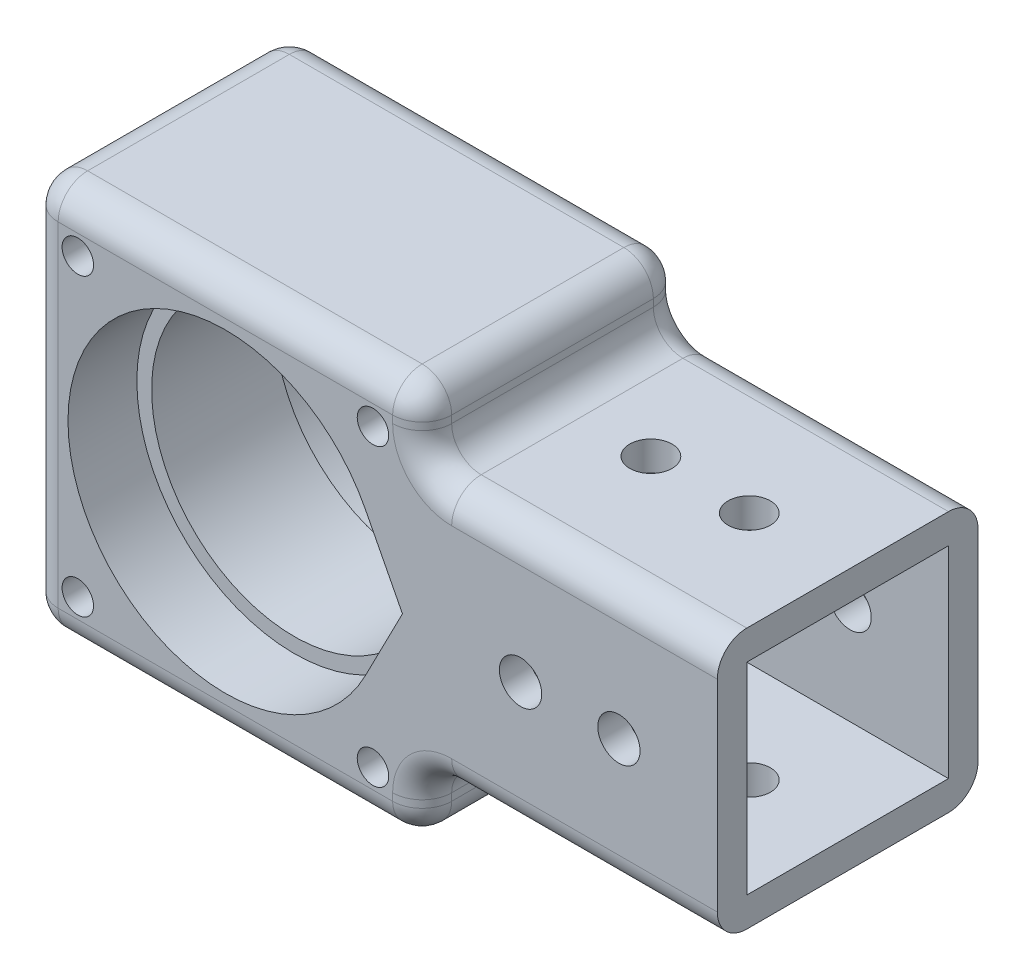
from build123d import *

# Parameters (mm, degrees)
SKETCH_1_W           = 17.5
SKETCH_1_H           = 17.5
EXTRUDE_1_DEPTH      = 30
SKETCH_2_W           = 20.5
SKETCH_2_H           = 20.5
SKETCH_2_W_2         = 17.5
SKETCH_2_H_2         = 17.5
EXTRUDE_2_DEPTH      = 2
SKETCH_3_W           = 26.5
SKETCH_3_H           = 26.5
SKETCH_3_W_2         = 20.5
SKETCH_3_H_2         = 20.5
EXTRUDE_3_DEPTH      = 30
SKETCH_4_R           = 2.15
CUT_EXTRUDE_6_DEPTH  = 43.164113888
SKETCH_6_W           = 10
SKETCH_6_H           = 26.5
SKETCH_6_H_2         = 6.75
EXTRUDE_5_DEPTH      = 40
SKETCH_14_R          = 1.6
CUT_EXTRUDE_9_DEPTH  = 52.983170353
SKETCH_5_R           = 2.15
CUT_EXTRUDE_10_DEPTH = 52.983170353
SKETCH_15_W          = 17.5
SKETCH_15_H          = 17.5
CUT_EXTRUDE_12_DEPTH = 28
CUT_EXTRUDE_13_DEPTH = 28
CUT_EXTRUDE_14_DEPTH = 59.099591221
SKETCH_18_R          = 16
CUT_EXTRUDE_15_DEPTH = 10
CUT_EXTRUDE_16_DEPTH = 10
SKETCH_20_W          = 40.335449496
SKETCH_20_H          = 40
CUT_EXTRUDE_17_DEPTH = 3
EXTRUDE_START        = -40
SKETCH_21_R          = 1.5
EXTRUDE_6_DEPTH      = 40
SKETCH_22_R          = 16
CUT_EXTRUDE_18_DEPTH = 40
SKETCH_24_W          = 40
SKETCH_24_H          = 40
SKETCH_24_R          = 1.6
SKETCH_24_R_2        = 14.5
EXTRUDE_7_DEPTH      = 12.5
SKETCH_25_R          = 1.6
EXTRUDE_8_DEPTH      = 7
FILLET_1_R           = 3
FILLET_2_R           = 3
FILLET_3_R           = 3
FILLET_4_R           = 3
FILLET_5_R           = 3
FILLET_6_R           = 3
FILLET_7_R           = 3
FILLET_8_R           = 3


with BuildPart() as part:
    # 草图1 → 凸台-拉伸1 (new body)
    with BuildSketch(Plane(origin=(0, 0, 0), x_dir=(0, 0, -1), z_dir=(1, 0, 0))):
        Rectangle(SKETCH_1_W, SKETCH_1_H)
    extrude(amount=EXTRUDE_1_DEPTH)

    # 草图2 → 凸台-拉伸2 (add)
    with BuildSketch(Plane.ZY):
        Rectangle(SKETCH_2_W, SKETCH_2_H)
        Rectangle(SKETCH_2_W_2, SKETCH_2_H_2, mode=Mode.SUBTRACT)
    extrude(amount=-EXTRUDE_2_DEPTH)

    # 草图3 → 凸台-拉伸3 (add)
    with BuildSketch(Plane.ZY):
        Rectangle(SKETCH_3_W, SKETCH_3_H)
        Rectangle(SKETCH_3_W_2, SKETCH_3_H_2, mode=Mode.SUBTRACT)
    extrude(amount=-EXTRUDE_3_DEPTH)

    # 草图4 → 切除-拉伸6 (cut, through all)
    with BuildSketch(Plane(origin=(0, 13.25, 0), x_dir=(1, 0, 0), z_dir=(0, 1, 0))):
        with Locations(Location((10, 0, 0), (0, 0, 270))):
            Circle(SKETCH_4_R)
        with Locations(Location((20, 0, 0), (0, 0, 270))):
            Circle(SKETCH_4_R)
    extrude(amount=-CUT_EXTRUDE_6_DEPTH, mode=Mode.SUBTRACT)

    # 草图6 → 凸台-拉伸5 (add)
    with BuildSketch(Plane.ZY):
        with Locations((-8.25, 0)):
            Rectangle(SKETCH_6_W, SKETCH_6_H)
        with Locations((-8.25, 16.625)):
            Rectangle(SKETCH_6_W, SKETCH_6_H_2)
        with Locations((-8.25, -16.625)):
            Rectangle(SKETCH_6_W, SKETCH_6_H_2)
    extrude(amount=EXTRUDE_5_DEPTH)

    # 草图14 → 切除-拉伸9 (cut, through all)
    with BuildSketch(Plane(origin=(0, 0, -13.25), x_dir=(-1, 0, 0), z_dir=(0, 0, -1))):
        with BuildLine():
            ThreePointArc((20, 15), (5, 0), (20, -15))
            Line((20, -15), (20, 15))
        make_face()
        with BuildLine():
            Line((20, 15), (20, -15))
            ThreePointArc((20, -15), (30.606601718, -10.606601718), (35, 0))
            ThreePointArc((35, 0), (30.606601718, 10.606601718), (20, 15))
        make_face()
        with Locations((5, -15)):
            Circle(SKETCH_14_R)
        with Locations((35, -15)):
            Circle(SKETCH_14_R)
        with Locations((35, 15)):
            Circle(SKETCH_14_R)
        with Locations((5, 15)):
            Circle(SKETCH_14_R)
    extrude(amount=-CUT_EXTRUDE_9_DEPTH, mode=Mode.SUBTRACT)

    # 草图5 → 切除-拉伸10 (cut, through all)
    with BuildSketch(Plane(origin=(0, 0, -13.25), x_dir=(-1, 0, 0), z_dir=(0, 0, -1))):
        with Locations(Location((-20, 0, 0), (0, 0, 180))):
            Circle(SKETCH_5_R)
        with Locations(Location((-10, 0, 0), (0, 0, 180))):
            Circle(SKETCH_5_R)
    extrude(amount=-CUT_EXTRUDE_10_DEPTH, mode=Mode.SUBTRACT)

    # 草图15 → 切除-拉伸12 (cut)
    with BuildSketch(Plane(origin=(30, 0, 0), x_dir=(0, 0, -1), z_dir=(1, 0, 0))):
        Rectangle(SKETCH_15_W, SKETCH_15_H)
    extrude(amount=-CUT_EXTRUDE_12_DEPTH, mode=Mode.SUBTRACT)

    # 草图16 → 切除-拉伸13 (cut)
    with BuildSketch(Plane.XY.offset(-3.25)):
        Polygon((-3, 0), (-6.796133828, 7.117437609), (-6.764657472, -7.058732759), align=None)
    extrude(amount=-CUT_EXTRUDE_13_DEPTH, mode=Mode.SUBTRACT)

    # 草图17 → 切除-拉伸14 (cut, through all)
    with BuildSketch(Plane(origin=(0, 20, 0), x_dir=(1, 0, 0), z_dir=(0, 1, 0))):
        with BuildLine():
            ThreePointArc((-18.5, 8.25), (-18.939339828, 9.310660172), (-20, 9.75))
            Line((-20, 9.75), (-20, 6.75))
            ThreePointArc((-20, 6.75), (-18.939339828, 7.189339828), (-18.5, 8.25))
        make_face()
        with BuildLine():
            Line((-20, 6.75), (-20, 9.75))
            ThreePointArc((-20, 9.75), (-21.5, 8.25), (-20, 6.75))
        make_face()
    extrude(amount=-CUT_EXTRUDE_14_DEPTH, mode=Mode.SUBTRACT)

    # 草图18 → 切除-拉伸15 (cut)
    with BuildSketch(Plane.XY.offset(-3.25)):
        with Locations((-20, 0)):
            Circle(SKETCH_18_R)
    extrude(amount=-CUT_EXTRUDE_15_DEPTH, mode=Mode.SUBTRACT)

    # 草图19 → 切除-拉伸16 (cut)
    with BuildSketch(Plane.XY.offset(-3.25)):
        with BuildLine():
            Line((-4.144564342, 2.145963672), (-3, 0))
            Line((-3, 0), (-2, 0))
            Line((-2, 0), (-5.777773972, 7.329958172))
            ThreePointArc((-5.777773972, 7.329958172), (-4.73943373, 4.807818333), (-4.144564342, 2.145963672))
        make_face()
        with BuildLine():
            Line((-2, 0), (-3, 0))
            Line((-3, 0), (-4.144581476, -2.146090268))
            ThreePointArc((-4.144581476, -2.146090268), (-4.739452924, -4.807879256), (-5.777773972, -7.329958172))
            Line((-5.777773972, -7.329958172), (-2, 0))
        make_face()
    extrude(amount=-CUT_EXTRUDE_16_DEPTH, mode=Mode.SUBTRACT)

    # 草图20 → 切除-拉伸17 (cut)
    with BuildSketch(Plane.XY.offset(-3.25)):
        with Locations((-20.167724748, 0)):
            Rectangle(SKETCH_20_W, SKETCH_20_H)
    extrude(amount=-CUT_EXTRUDE_17_DEPTH, mode=Mode.SUBTRACT)

    # 草图21 → 凸台-拉伸6 (add)
    with BuildSketch(Plane.XZ.offset(20).offset(EXTRUDE_START)):
        with Locations(Location((-20, -8.25, 0), (0, 0, 90))):
            Circle(SKETCH_21_R)
    extrude(amount=EXTRUDE_6_DEPTH)

    # 草图22 → 切除-拉伸18 (cut)
    with BuildSketch(Plane.XY.offset(-6.25)):
        with Locations((-20, 0)):
            Circle(SKETCH_22_R)
    extrude(amount=-CUT_EXTRUDE_18_DEPTH, mode=Mode.SUBTRACT)

    # 草图24 → 凸台-拉伸7 (add)
    with BuildSketch(Plane.XY.offset(-6.25)):
        with Locations((-20, 0)):
            Rectangle(SKETCH_24_W, SKETCH_24_H)
        with Locations(Location((-35, 15, 0), (0, 0, 180))):
            Circle(SKETCH_24_R, mode=Mode.SUBTRACT)
        with Locations(Location((-35, -15, 0), (0, 0, 180))):
            Circle(SKETCH_24_R, mode=Mode.SUBTRACT)
        with Locations(Location((-5, -15, 0), (0, 0, 180))):
            Circle(SKETCH_24_R, mode=Mode.SUBTRACT)
        with Locations(Location((-5, 15, 0), (0, 0, 180))):
            Circle(SKETCH_24_R, mode=Mode.SUBTRACT)
        with Locations((-20, 0)):
            Circle(SKETCH_24_R_2, mode=Mode.SUBTRACT)
    extrude(amount=EXTRUDE_7_DEPTH)

    # 草图25 → 凸台-拉伸8 (add)
    with BuildSketch(Plane.XY.offset(6.25)):
        Polygon((0, 20), (-40, 20), (-40, -20), (0, -20), (0, -13.25), (0, 13.25), align=None)
        with Locations(Location((-35, -15, 0), (0, 0, 180))):
            Circle(SKETCH_25_R, mode=Mode.SUBTRACT)
        with Locations(Location((-5, -15, 0), (0, 0, 180))):
            Circle(SKETCH_25_R, mode=Mode.SUBTRACT)
        with Locations(Location((-35, 15, 0), (0, 0, 180))):
            Circle(SKETCH_25_R, mode=Mode.SUBTRACT)
        with BuildLine():
            Line((-5.777773972, 7.329958172), (-2, 0))
            Line((-2, 0), (-5.777773972, -7.329958172))
            ThreePointArc((-5.777773972, -7.329958172), (-36, 0), (-5.777773972, 7.329958172))
        make_face(mode=Mode.SUBTRACT)
        with Locations(Location((-5, 15, 0), (0, 0, 180))):
            Circle(SKETCH_25_R, mode=Mode.SUBTRACT)
    extrude(amount=EXTRUDE_8_DEPTH)

    # 圆角1
    fillet_1_edges = [part.edges().sort_by_distance(p)[0] for p in [
        (0, 20, 0),
    ]]
    fillet(fillet_1_edges, radius=FILLET_1_R)

    # 圆角2
    fillet_2_edges = [part.edges().sort_by_distance(p)[0] for p in [
        (0, 13.25, 0),
    ]]
    fillet(fillet_2_edges, radius=FILLET_2_R)

    # 圆角3
    fillet_3_edges = [part.edges().sort_by_distance(p)[0] for p in [
        (-40, 20, 0),
    ]]
    fillet(fillet_3_edges, radius=FILLET_3_R)

    # 圆角4
    fillet_4_edges = [part.edges().sort_by_distance(p)[0] for p in [
        (-40, -20, 0),
    ]]
    fillet(fillet_4_edges, radius=FILLET_4_R)

    # 圆角5
    fillet_5_edges = [part.edges().sort_by_distance(p)[0] for p in [
        (0, -20, 0),
    ]]
    fillet(fillet_5_edges, radius=FILLET_5_R)

    # 圆角6
    fillet_6_edges = [part.edges().sort_by_distance(p)[0] for p in [
        (0, -13.25, 0),
    ]]
    fillet(fillet_6_edges, radius=FILLET_6_R)

    # 圆角7
    fillet_7_edges = [part.edges().sort_by_distance(p)[0] for p in [
        (0, 16.625, -13.25),
        (-0.878679656, 19.121320344, -13.25),
        (0.878679656, 14.128679656, -13.25),
        (-40, 0, -13.25),
        (-20, 20, -13.25),
        (16.5, -13.25, -13.25),
        (-39.121320344, 19.121320344, -13.25),
        (16.5, 13.25, -13.25),
        (-20, -20, -13.25),
        (-39.121320344, -19.121320344, -13.25),
        (-0.878679656, -19.121320344, -13.25),
        (0, -16.625, -13.25),
        (0.878679656, -14.128679656, -13.25),
    ]]
    fillet(fillet_7_edges, radius=FILLET_7_R)

    # 圆角8
    fillet_8_edges = [part.edges().sort_by_distance(p)[0] for p in [
        (-20, 20, 13.25),
        (-0.878679656, 19.121320344, 13.25),
        (0, 16.625, 13.25),
        (0.878679656, 14.128679656, 13.25),
        (16.5, -13.25, 13.25),
        (-40, 0, 13.25),
        (-39.121320344, 19.121320344, 13.25),
        (16.5, 13.25, 13.25),
        (-20, -20, 13.25),
        (-39.121320344, -19.121320344, 13.25),
        (0, -16.625, 13.25),
        (-0.878679656, -19.121320344, 13.25),
        (0.878679656, -14.128679656, 13.25),
    ]]
    fillet(fillet_8_edges, radius=FILLET_8_R)


solid = part.part
